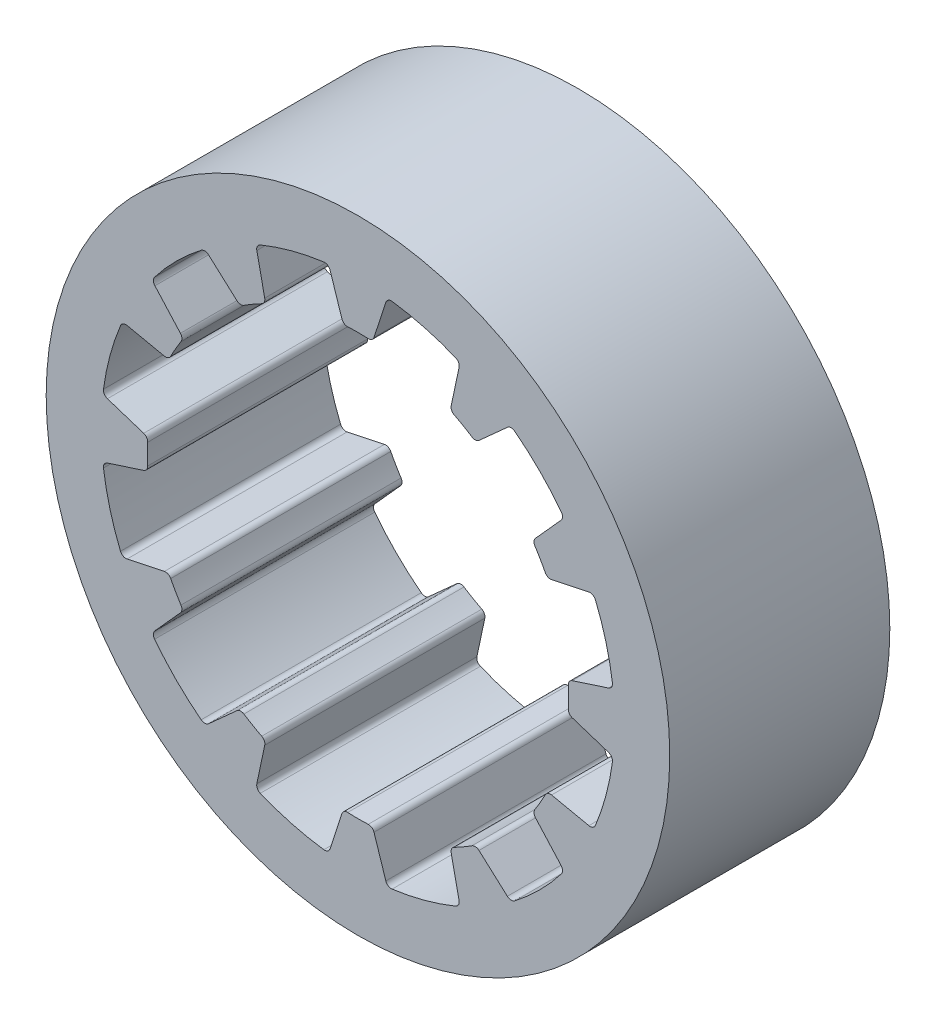
from build123d import *

# Parameters (mm, degrees)
MODEL_R             = 26.9875
BOSS_EXTRUDE1_DEPTH = 19.05


with BuildPart() as part:
    # Model → Boss-Extrude1 (new body)
    with BuildSketch(Plane.XY):
        with Locations(Location((0, 0, 0), (0, 0, 180))):
            Circle(MODEL_R)
        with BuildLine():
            Line((-8.070485832, 16.757663602), (-8.754511726, 19.987689799))
            ThreePointArc((-8.754511726, 19.987689799), (-8.707484905, 20.324784918), (-8.455586843, 20.553677922))
            ThreePointArc((-8.455586843, 20.553677922), (-5.752253282, 21.467701488), (-2.95408596, 22.027800642))
            ThreePointArc((-2.95408596, 22.027800642), (-2.621489336, 21.955522516), (-2.412215355, 21.687102989))
            Line((-2.412215355, 21.687102989), (-1.38958606, 18.5478053))
            ThreePointArc((-1.38958606, 18.5478053), (-1.197947162, 18.291000428), (-0.889763559, 18.203267447))
            ThreePointArc((-0.889763559, 18.203267447), (-4e-09, 18.224999999), (0.88976355, 18.203267448))
            ThreePointArc((0.88976355, 18.203267448), (1.197947153, 18.291000429), (1.38958605, 18.547805301))
            Line((1.38958605, 18.547805301), (2.412215346, 21.68710299))
            ThreePointArc((2.412215346, 21.68710299), (2.621489327, 21.955522516), (2.954085951, 22.027800641))
            ThreePointArc((2.954085951, 22.027800641), (5.752253273, 21.467701488), (8.455586835, 20.553677923))
            ThreePointArc((8.455586835, 20.553677923), (8.707484897, 20.324784919), (8.754511717, 19.9876898))
            Line((8.754511717, 19.9876898), (8.070485823, 16.757663603))
            ThreePointArc((8.070485823, 16.757663603), (8.108047539, 16.439444611), (8.331075878, 16.209373819))
            ThreePointArc((8.331075878, 16.209373819), (9.112499995, 15.783312983), (9.872191562, 15.319610264))
            ThreePointArc((9.872191562, 15.319610264), (10.182952881, 15.241497453), (10.47731947, 15.368077548))
            Line((10.47731947, 15.368077548), (12.932591265, 17.575474446))
            ThreePointArc((12.932591265, 17.575474446), (13.248037611, 17.703295585), (13.572213798, 17.599591967))
            ThreePointArc((13.572213798, 17.599591967), (15.715448207, 15.71544821), (17.599591964, 13.572213802))
            ThreePointArc((17.599591964, 13.572213802), (17.703295582, 13.248037614), (17.575474443, 12.932591268))
            Line((17.575474443, 12.932591268), (15.368077544, 10.477319473))
            ThreePointArc((15.368077544, 10.477319473), (15.24149745, 10.182952884), (15.319610261, 9.872191565))
            ThreePointArc((15.319610261, 9.872191565), (15.78331298, 9.112499998), (16.209373816, 8.331075881))
            ThreePointArc((16.209373816, 8.331075881), (16.439444608, 8.108047543), (16.7576636, 8.070485826))
            Line((16.7576636, 8.070485826), (19.987689797, 8.75451172))
            ThreePointArc((19.987689797, 8.75451172), (20.324784916, 8.707484899), (20.55367792, 8.455586837))
            ThreePointArc((20.55367792, 8.455586837), (21.467701485, 5.752253275), (22.027800638, 2.954085954))
            ThreePointArc((22.027800638, 2.954085954), (21.955522513, 2.62148933), (21.687102986, 2.412215349))
            Line((21.687102986, 2.412215349), (18.547805297, 1.389586053))
            ThreePointArc((18.547805297, 1.389586053), (18.291000425, 1.197947156), (18.203267445, 0.889763553))
            ThreePointArc((18.203267445, 0.889763553), (18.224999996, -2e-09), (18.203267445, -0.889763556))
            ThreePointArc((18.203267445, -0.889763556), (18.291000425, -1.19794716), (18.547805298, -1.389586057))
            Line((18.547805298, -1.389586057), (21.687102987, -2.412215353))
            ThreePointArc((21.687102987, -2.412215353), (21.955522514, -2.621489333), (22.027800639, -2.954085957))
            ThreePointArc((22.027800639, -2.954085957), (21.467701485, -5.752253279), (20.55367792, -8.455586841))
            ThreePointArc((20.55367792, -8.455586841), (20.324784915, -8.707484903), (19.987689796, -8.754511723))
            Line((19.987689796, -8.754511723), (16.757663599, -8.070485829))
            ThreePointArc((16.757663599, -8.070485829), (16.439444608, -8.108047546), (16.209373816, -8.331075885))
            ThreePointArc((16.209373816, -8.331075885), (15.78331298, -9.112500002), (15.319610261, -9.872191568))
            ThreePointArc((15.319610261, -9.872191568), (15.24149745, -10.182952888), (15.368077545, -10.477319476))
            Line((15.368077545, -10.477319476), (17.575474443, -12.932591272))
            ThreePointArc((17.575474443, -12.932591272), (17.703295583, -13.248037618), (17.599591965, -13.572213805))
            ThreePointArc((17.599591965, -13.572213805), (15.715448207, -15.715448213), (13.572213799, -17.59959197))
            ThreePointArc((13.572213799, -17.59959197), (13.248037611, -17.703295588), (12.932591265, -17.575474449))
            Line((12.932591265, -17.575474449), (10.47731947, -15.368077551))
            ThreePointArc((10.47731947, -15.368077551), (10.182952881, -15.241497457), (9.872191562, -15.319610268))
            ThreePointArc((9.872191562, -15.319610268), (9.112499996, -15.783312986), (8.331075878, -16.209373822))
            ThreePointArc((8.331075878, -16.209373822), (8.108047539, -16.439444614), (8.070485823, -16.757663607))
            Line((8.070485823, -16.757663607), (8.754511717, -19.987689803))
            ThreePointArc((8.754511717, -19.987689803), (8.707484897, -20.324784922), (8.455586834, -20.553677926))
            ThreePointArc((8.455586834, -20.553677926), (5.752253273, -21.467701491), (2.954085951, -22.027800644))
            ThreePointArc((2.954085951, -22.027800644), (2.621489325, -21.955522517), (2.412215346, -21.687102985))
            Line((2.412215346, -21.687102985), (1.38958605, -18.547805297))
            ThreePointArc((1.38958605, -18.547805297), (1.197947153, -18.291000425), (0.889763549, -18.203267444))
            ThreePointArc((0.889763549, -18.203267444), (-4e-09, -18.224999995), (-0.889763558, -18.203267444))
            ThreePointArc((-0.889763558, -18.203267444), (-1.197947162, -18.291000425), (-1.389586059, -18.547805297))
            Line((-1.389586059, -18.547805297), (-2.412215354, -21.687102986))
            ThreePointArc((-2.412215354, -21.687102986), (-2.621489335, -21.955522513), (-2.954085959, -22.027800639))
            ThreePointArc((-2.954085959, -22.027800639), (-5.75225328, -21.467701485), (-8.455586841, -20.55367792))
            ThreePointArc((-8.455586841, -20.55367792), (-8.707484903, -20.324784915), (-8.754511723, -19.987689797))
            Line((-8.754511723, -19.987689797), (-8.070485829, -16.7576636))
            ThreePointArc((-8.070485829, -16.7576636), (-8.108047546, -16.439444608), (-8.331075884, -16.209373816))
            ThreePointArc((-8.331075884, -16.209373816), (-9.112500001, -15.78331298), (-9.872191567, -15.319610262))
            ThreePointArc((-9.872191567, -15.319610262), (-10.182952886, -15.241497451), (-10.477319475, -15.368077546))
            Line((-10.477319475, -15.368077546), (-12.93259127, -17.575474444))
            ThreePointArc((-12.93259127, -17.575474444), (-13.248037616, -17.703295583), (-13.572213803, -17.599591965))
            ThreePointArc((-13.572213803, -17.599591965), (-15.715448211, -15.715448209), (-17.599591967, -13.572213801))
            ThreePointArc((-17.599591967, -13.572213801), (-17.703295585, -13.248037614), (-17.575474446, -12.932591267))
            Line((-17.575474446, -12.932591267), (-15.368077548, -10.477319472))
            ThreePointArc((-15.368077548, -10.477319472), (-15.241497453, -10.182952883), (-15.319610265, -9.872191564))
            ThreePointArc((-15.319610265, -9.872191564), (-15.783312983, -9.112499999), (-16.209373818, -8.331075882))
            ThreePointArc((-16.209373818, -8.331075882), (-16.439444611, -8.108047543), (-16.757663603, -8.070485827))
            Line((-16.757663603, -8.070485827), (-19.9876898, -8.754511721))
            ThreePointArc((-19.9876898, -8.754511721), (-20.324784919, -8.7074849), (-20.553677923, -8.455586838))
            ThreePointArc((-20.553677923, -8.455586838), (-21.467701487, -5.752253277), (-22.027800641, -2.954085957))
            ThreePointArc((-22.027800641, -2.954085957), (-21.955522516, -2.621489333), (-21.687102989, -2.412215352))
            Line((-21.687102989, -2.412215352), (-18.5478053, -1.389586056))
            ThreePointArc((-18.5478053, -1.389586056), (-18.291000428, -1.197947159), (-18.203267448, -0.889763556))
            ThreePointArc((-18.203267448, -0.889763556), (-18.224999999, -2e-09), (-18.203267448, 0.889763552))
            ThreePointArc((-18.203267448, 0.889763552), (-18.291000429, 1.197947155), (-18.547805301, 1.389586052))
            Line((-18.547805301, 1.389586052), (-21.68710299, 2.412215348))
            ThreePointArc((-21.68710299, 2.412215348), (-21.955522518, 2.621489329), (-22.027800643, 2.954085953))
            ThreePointArc((-22.027800643, 2.954085953), (-21.46770149, 5.752253274), (-20.553677925, 8.455586836))
            ThreePointArc((-20.553677925, 8.455586836), (-20.324784921, 8.707484898), (-19.987689802, 8.754511718))
            Line((-19.987689802, 8.754511718), (-16.757663605, 8.070485824))
            ThreePointArc((-16.757663605, 8.070485824), (-16.439444614, 8.108047541), (-16.209373822, 8.331075879))
            ThreePointArc((-16.209373822, 8.331075879), (-15.783312986, 9.112499997), (-15.319610268, 9.872191563))
            ThreePointArc((-15.319610268, 9.872191563), (-15.241497457, 10.182952882), (-15.368077552, 10.477319471))
            Line((-15.368077552, 10.477319471), (-17.57547445, 12.932591266))
            ThreePointArc((-17.57547445, 12.932591266), (-17.703295589, 13.248037612), (-17.599591971, 13.572213799))
            ThreePointArc((-17.599591971, 13.572213799), (-15.715448215, 15.715448208), (-13.572213807, 17.599591965))
            ThreePointArc((-13.572213807, 17.599591965), (-13.24803762, 17.703295583), (-12.932591273, 17.575474444))
            Line((-12.932591273, 17.575474444), (-10.477319478, 15.368077546))
            ThreePointArc((-10.477319478, 15.368077546), (-10.182952889, 15.241497452), (-9.87219157, 15.319610263))
            ThreePointArc((-9.87219157, 15.319610263), (-9.112500004, 15.783312982), (-8.331075887, 16.209373818))
            ThreePointArc((-8.331075887, 16.209373818), (-8.108047548, 16.43944461), (-8.070485832, 16.757663602))
        make_face(mode=Mode.SUBTRACT)
    extrude(amount=BOSS_EXTRUDE1_DEPTH)


solid = part.part
